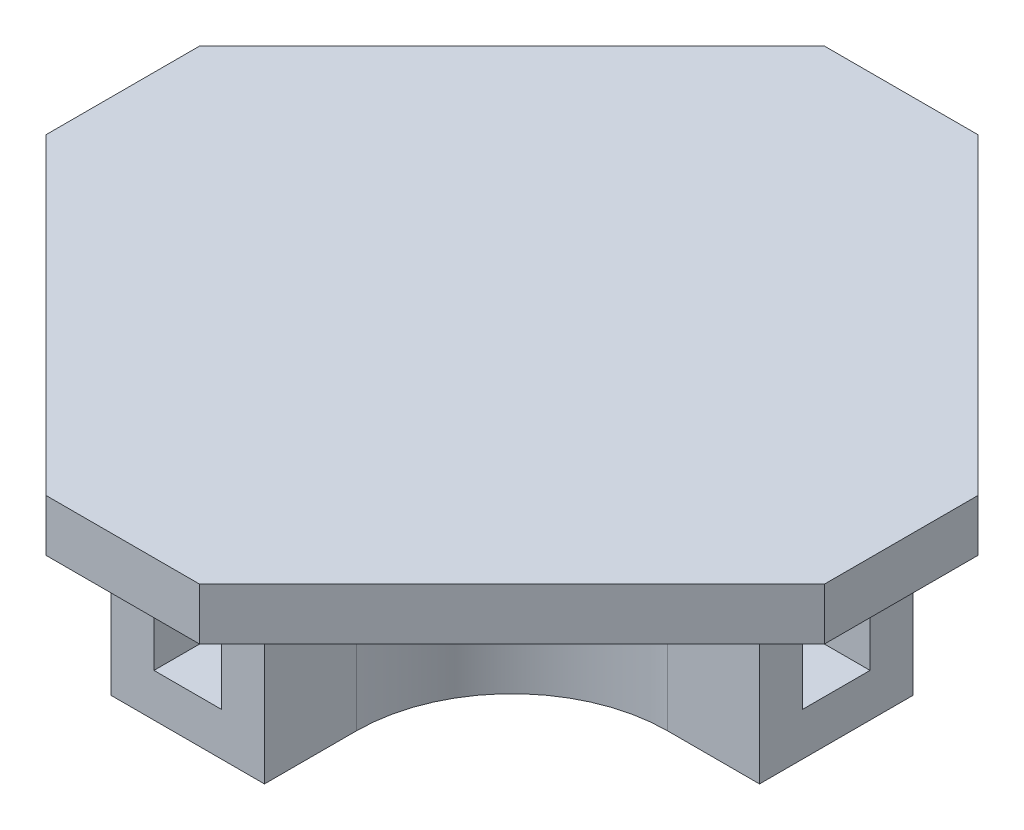
from build123d import *

# Parameters (mm, degrees)
BOSS_EXTRUDE1_DEPTH = 7.5184
SKETCH2_W           = 3.302
SKETCH2_H           = 3.302
CUT_EXTRUDE1_DEPTH  = 12.7
CIRPATTERN1_COUNT   = 4
BOSS_EXTRUDE2_DEPTH = 2.54


with BuildPart() as part:
    # Sketch1 → Boss-Extrude1 (new body)
    with BuildSketch(Plane(origin=(0, 0, 0), x_dir=(1, 0, 0), z_dir=(0, 1, 0))):
        with BuildLine():
            Line((3.7592, 11.3792), (3.7592, 15.875))
            Line((3.7592, 15.875), (-3.7592, 15.875))
            Line((-3.7592, 15.875), (-3.7592, 11.3792))
            ThreePointArc((-3.7592, 11.3792), (-5.991046327, 5.991046327), (-11.3792, 3.7592))
            Line((-11.3792, 3.7592), (-15.875, 3.7592))
            Line((-15.875, 3.7592), (-15.875, -3.7592))
            Line((-15.875, -3.7592), (-11.3792, -3.7592))
            ThreePointArc((-11.3792, -3.7592), (-5.991046327, -5.991046327), (-3.7592, -11.3792))
            Line((-3.7592, -11.3792), (-3.7592, -15.875))
            Line((-3.7592, -15.875), (3.7592, -15.875))
            Line((3.7592, -15.875), (3.7592, -11.3792))
            ThreePointArc((3.7592, -11.3792), (5.991046327, -5.991046327), (11.3792, -3.7592))
            Line((11.3792, -3.7592), (15.875, -3.7592))
            Line((15.875, -3.7592), (15.875, 3.7592))
            Line((15.875, 3.7592), (11.3792, 3.7592))
            ThreePointArc((11.3792, 3.7592), (5.991046327, 5.991046327), (3.7592, 11.3792))
        make_face()
    extrude(amount=-BOSS_EXTRUDE1_DEPTH)

    # Sketch2 → Cut-Extrude1 (cut)
    with BuildSketch(Plane.XY.offset(15.875)):
        with Locations((0, -3.7592)):
            Rectangle(SKETCH2_W, SKETCH2_H)
    cut_extrude1 = extrude(amount=-CUT_EXTRUDE1_DEPTH, mode=Mode.SUBTRACT)

    # CirPattern1: Cut-Extrude1 ×4 about axis
    cirpattern1_axis = Axis((0, -22.390859054, 0), (0, 1, 0))
    for i in range(1, CIRPATTERN1_COUNT):
        add(cut_extrude1.rotate(cirpattern1_axis, i * 360 / CIRPATTERN1_COUNT), mode=Mode.SUBTRACT)

    # Sketch4 → Boss-Extrude2 (add)
    with BuildSketch(Plane(origin=(0, 0, 0), x_dir=(1, 0, 0), z_dir=(0, 1, 0))):
        Polygon((3.7592, 19.05), (19.05, 3.7592), (19.05, -3.7592), (3.7592, -19.05), (-3.7592, -19.05), (-19.05, -3.7592), (-19.05, 3.7592), (-3.7592, 19.05), align=None)
    extrude(amount=BOSS_EXTRUDE2_DEPTH)


solid = part.part
